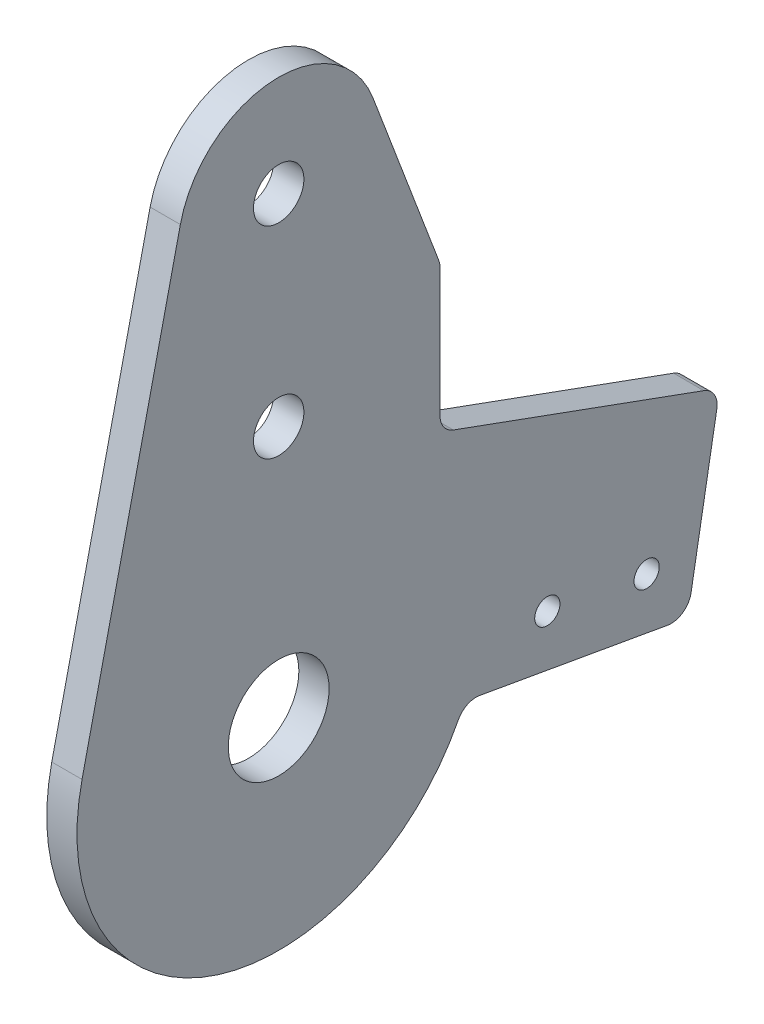
from build123d import *

# Parameters (mm, degrees)
SKETCH1_R           = 5
SKETCH1_R_2         = 2.5
SKETCH1_R_3         = 1.25
BOSS_EXTRUDE1_DEPTH = 3
FILLET1_R           = 2


with BuildPart() as part:
    # Sketch1 → Boss-Extrude1 (new body)
    with BuildSketch(Plane(origin=(0, 0, 0), x_dir=(0, 0, -1), z_dir=(1, 0, 0))):
        with BuildLine():
            Line((-59.74996043, 17.222222222), (-69.499920861, -25.555555556))
            ThreePointArc((-69.499920861, -25.555555556), (-56.144118615, -49.032861226), (-31.582037919, -37.796067776))
            Line((-31.582037919, -37.796067776), (-9.457329759, -41.697250765))
            Line((-9.457329759, -41.697250765), (-6.26133088, -23.571840424))
            Line((-6.26133088, -23.571840424), (-34, -13.475790526))
            Line((-34, -13.475790526), (-34, 1))
            Line((-34, 1), (-40.649042421, 18.543951518))
            ThreePointArc((-40.649042421, 18.543951518), (-50.690320869, 24.9761444), (-59.74996043, 17.222222222))
        make_face()
        with Locations((-50, -30)):
            Circle(SKETCH1_R, mode=Mode.SUBTRACT)
        with Locations((-50, 15)):
            Circle(SKETCH1_R_2, mode=Mode.SUBTRACT)
        with Locations((-50, -5)):
            Circle(SKETCH1_R_2, mode=Mode.SUBTRACT)
        with Locations((-23.361205166, -34.168489335)):
            Circle(SKETCH1_R_3, mode=Mode.SUBTRACT)
        with Locations((-13.513127636, -35.904971111)):
            Circle(SKETCH1_R_3, mode=Mode.SUBTRACT)
    extrude(amount=BOSS_EXTRUDE1_DEPTH)

    # Fillet1
    fillet1_edges = [part.edges().sort_by_distance(p)[0] for p in [
        (1.5, 1, 34),
        (1.5, -13.475790526, 34),
        (1.5, -23.571840424, 6.26133088),
        (1.5, -41.697250765, 9.457329759),
        (1.5, -37.796067776, 31.582037919),
    ]]
    fillet(fillet1_edges, radius=FILLET1_R)


solid = part.part
